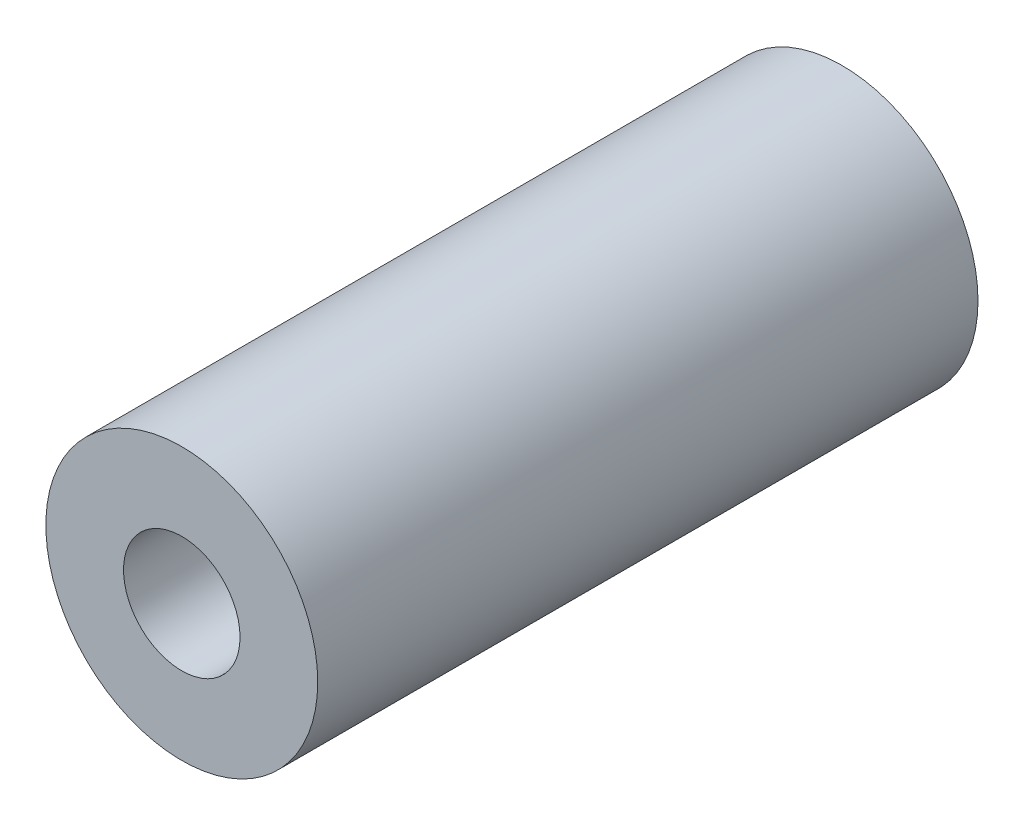
from build123d import *

# Parameters (mm, degrees)
SKETCH2_R           = 3.5
SKETCH2_R_2         = 1.5
BOSS_EXTRUDE1_DEPTH = 17


with BuildPart() as part:
    # Sketch2 → Boss-Extrude1 (new body)
    with BuildSketch(Plane.XY):
        Circle(SKETCH2_R)
        Circle(SKETCH2_R_2, mode=Mode.SUBTRACT)
    extrude(amount=BOSS_EXTRUDE1_DEPTH)


solid = part.part
